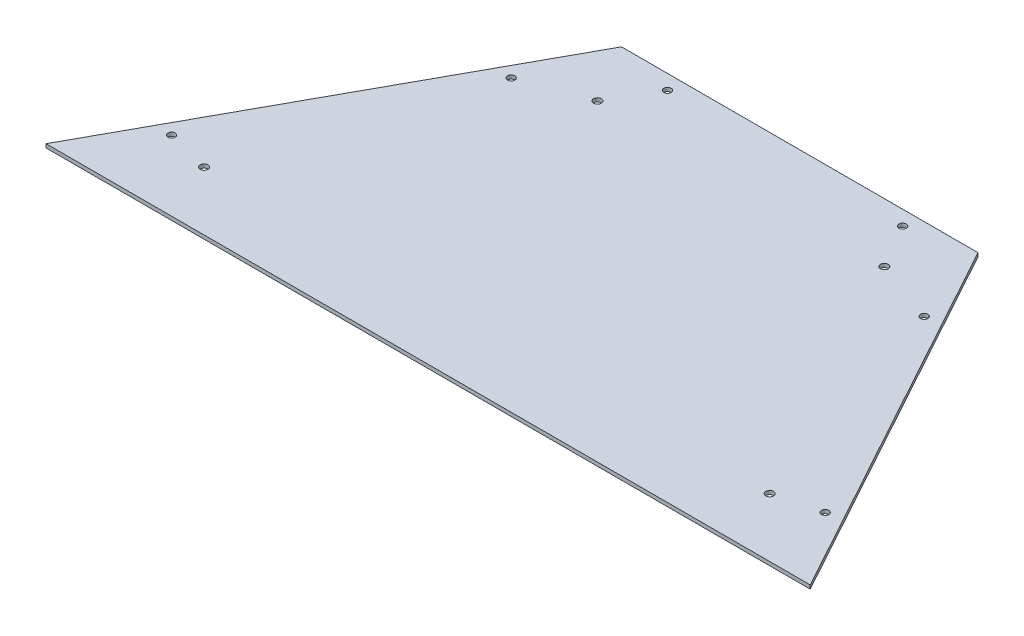
from build123d import *

# Parameters (mm, degrees)
BOSS_EXTRUDE1_DEPTH         = 3.175
F_1_4_0_25_DIAMETER_HOLE1_D = 6.35
F_1_4_CLEARANCE_HOLE1_D     = 6.7564


with BuildPart() as part:
    # Sketch1 → Boss-Extrude1 (new body)
    with BuildSketch(Plane(origin=(0, 0, 0), x_dir=(1, 0, 0), z_dir=(0, 1, 0))):
        Polygon((-330.2, 0), (-154.051, 321.128911223), (154.051, 321.128911223), (330.2, 0), align=None)
    extrude(amount=BOSS_EXTRUDE1_DEPTH)

    # 1/4 (0.25) Diameter Hole1 (through all)
    with Locations(Plane(origin=(0, 3.175, 0), x_dir=(1, 0, 0), z_dir=(0, 1, 0))):
        with Locations((-282.418345658, 60.701264471), (-178.463561331, 250.216315407), (-101.6, 308.428911223), (282.418345658, 60.701264471), (178.463561331, 250.216315407), (101.6, 308.428911223)):
            Hole(F_1_4_0_25_DIAMETER_HOLE1_D / 2)

    # 1/4 Clearance Hole1 (through all)
    with Locations(Plane(origin=(0, 3.175, 0), x_dir=(1, 0, 0), z_dir=(0, 1, 0))):
        with Locations((-123.952, 270.256), (-244.348, 50.8), (244.348, 50.8), (123.952, 270.256)):
            Hole(F_1_4_CLEARANCE_HOLE1_D / 2)


solid = part.part
